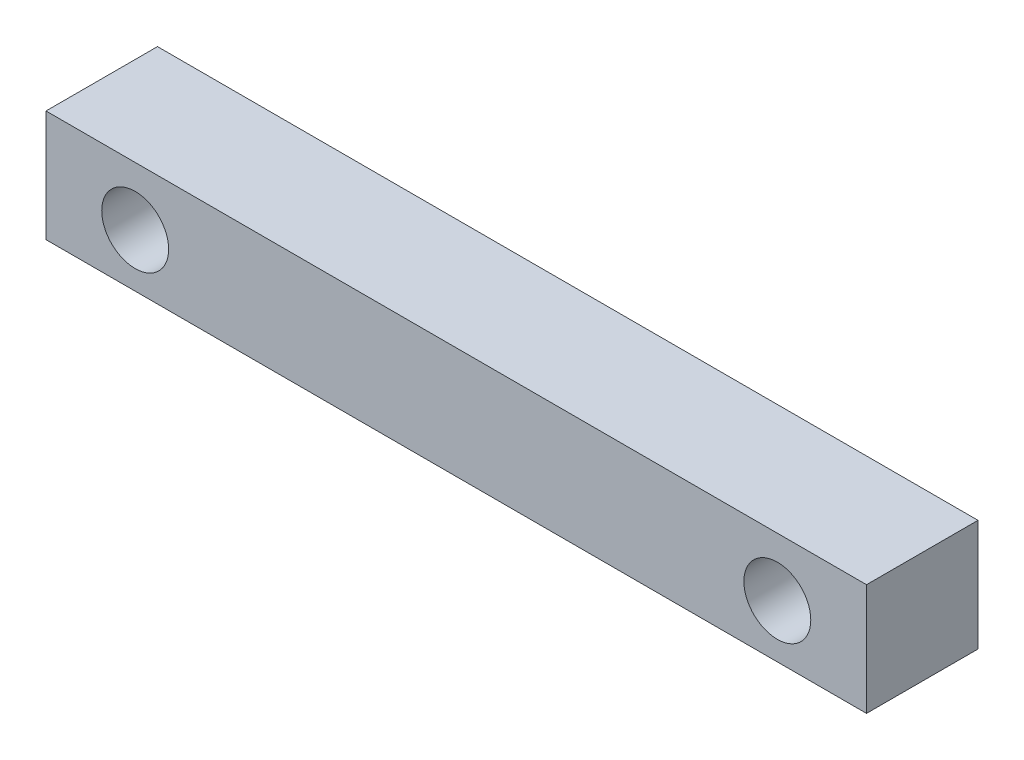
from build123d import *

# Parameters (mm, degrees)
SKETCH1_W               = 184
SKETCH1_H               = 25
BOSS_EXTRUDE1_DEPTH     = 25
CUT_EXTRUDE1_DEPTH      = 97.234200727
CUT_EXTRUDE1_DEPTH_BACK = 97.234200727
SKETCH2_R               = 7.5


with BuildPart() as part:
    # Sketch1 → Boss-Extrude1 (new body)
    with BuildSketch(Plane.XY):
        with Locations((0, 0.615692496)):
            Rectangle(SKETCH1_W, SKETCH1_H)
    extrude(amount=BOSS_EXTRUDE1_DEPTH)

    # Sketch2 → Cut-Extrude1 (cut, two sides: drawn at the far end of the back side and taken through both)
    with BuildSketch(Plane.XY.offset(25).offset(-CUT_EXTRUDE1_DEPTH_BACK)):
        with Locations((-72, 0)):
            Circle(SKETCH2_R)
        with Locations((72, 0)):
            Circle(SKETCH2_R)
    extrude(amount=CUT_EXTRUDE1_DEPTH + CUT_EXTRUDE1_DEPTH_BACK, mode=Mode.SUBTRACT)


solid = part.part
